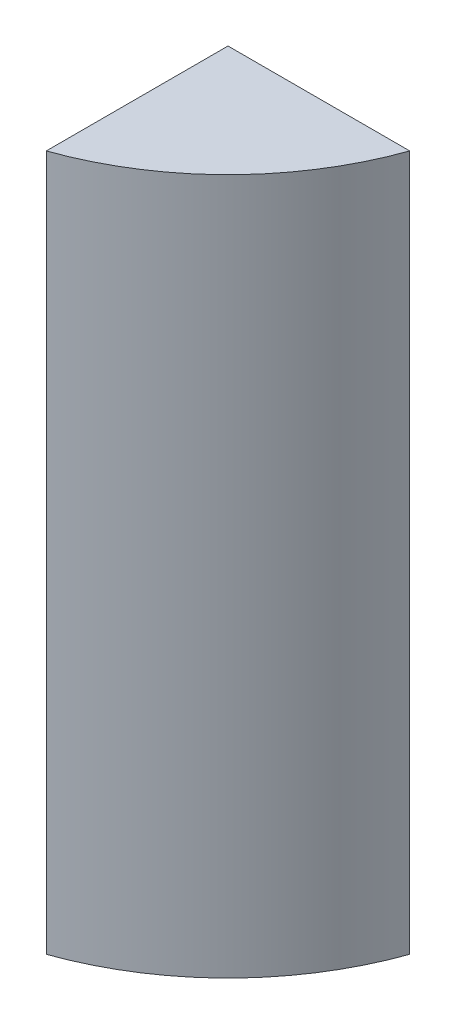
from build123d import *

# Parameters (mm, degrees)
EXTRUDE_1_DEPTH = 140


with BuildPart() as part:
    # 草图1 → 凸台-拉伸1 (new body)
    with BuildSketch(Plane(origin=(0, 0, 0), x_dir=(1, 0, 0), z_dir=(0, 1, 0))):
        with BuildLine():
            Line((56.568542495, -20), (20, -20))
            Line((20, -20), (20, -56.568542495))
            ThreePointArc((20, -56.568542495), (42.426406871, -42.426406871), (56.568542495, -20))
        make_face()
    extrude(amount=EXTRUDE_1_DEPTH)


solid = part.part
